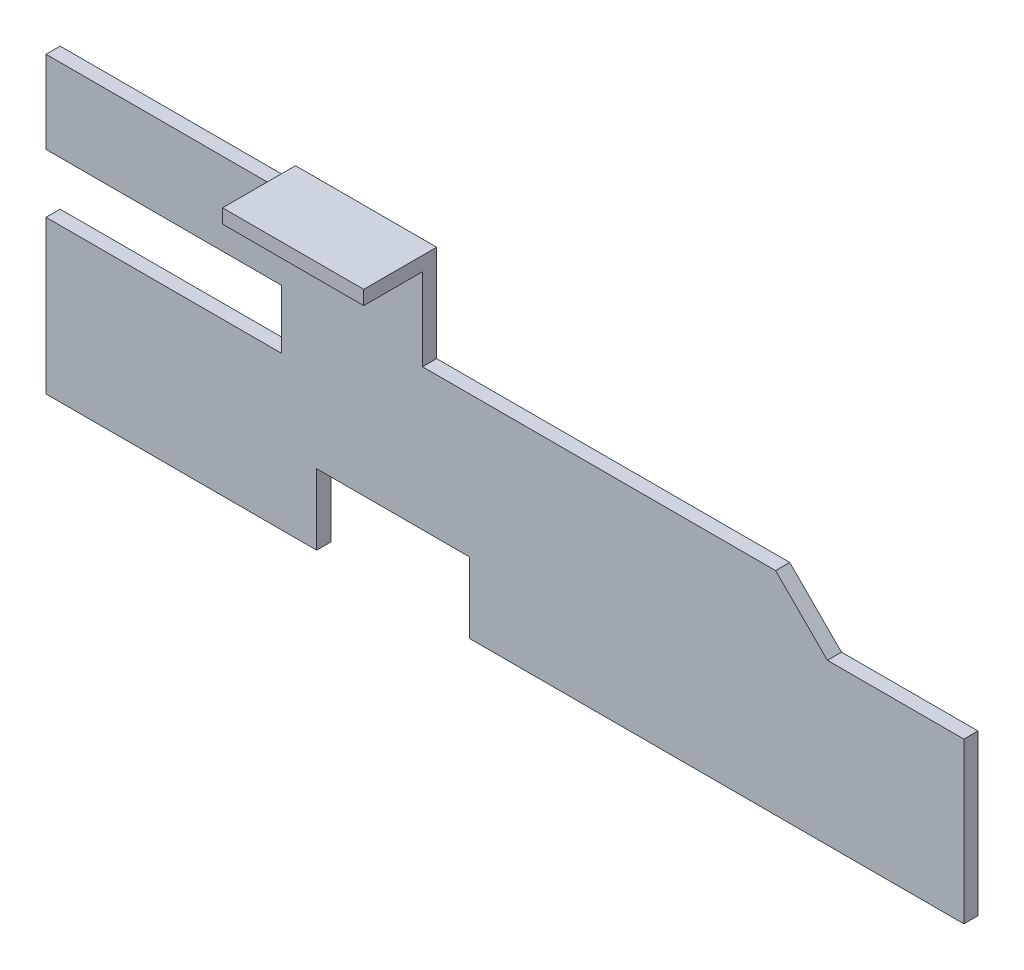
from build123d import *

# Parameters (mm, degrees)
EXTRUDE_1_DEPTH     = 0.6
SKETCH_2_W          = 6
SKETCH_2_H          = 0.6
EXTRUDE_2_DEPTH     = 2.5
SKETCH_4_W          = 6
SKETCH_4_H          = 1.9
CUT_EXTRUDE_1_DEPTH = 42.859885332


with BuildPart() as part:
    # 草图1 → 凸台-拉伸1 (new body)
    with BuildSketch(Plane.XY):
        Polygon((0, 0), (11.5, 0), (11.5, 3), (18, 3), (18, 0), (39, 0), (39, 6.8), (33.2, 6.8), (31, 9), (16, 9), (16, 15), (10, 15), (10, 12.5), (0, 12.5), (0, 9), (10, 9), (10, 6.5), (0, 6.5), align=None)
    extrude(amount=EXTRUDE_1_DEPTH)

    # 草图2 → 凸台-拉伸2 (add)
    with BuildSketch(Plane.XY.offset(0.6)):
        with Locations((13, 12.8)):
            Rectangle(SKETCH_2_W, SKETCH_2_H)
    extrude(amount=EXTRUDE_2_DEPTH)

    # 草图4 → 切除-拉伸1 (cut, through all)
    with BuildSketch(Plane.XY.offset(0.6)):
        with Locations((13, 14.05)):
            Rectangle(SKETCH_4_W, SKETCH_4_H)
    extrude(amount=-CUT_EXTRUDE_1_DEPTH, mode=Mode.SUBTRACT)


solid = part.part
